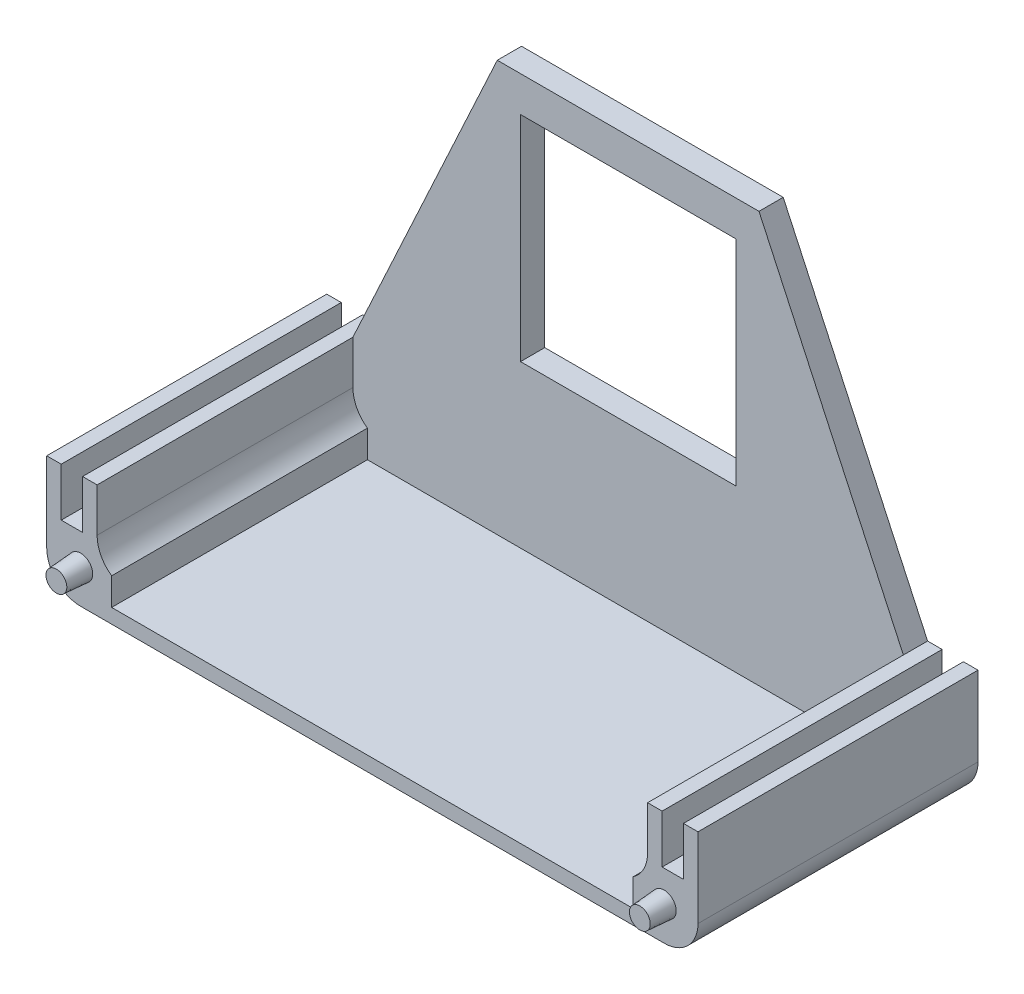
from build123d import *

# Parameters (mm, degrees)
EXTRUDE2_DEPTH               = 57.786
SKETCH2_R                    = 2.5
EXTRUDE3_DEPTH               = 5
EXTRUDE3_DRAFT               = 4
EXTRUDE3_PROFILE_2_DEPTH     = 5
EXTRUDE3_PROFILE_2_DRAFT     = 4
SKETCH4_R                    = 2.6
CUT_EXTRUDE1_DEPTH           = 5.2
CUT_EXTRUDE1_DRAFT           = -3.8
CUT_EXTRUDE1_PROFILE_2_DEPTH = 5.2
CUT_EXTRUDE1_PROFILE_2_DRAFT = -3.8
SKETCH3_W                    = 44.4182
SKETCH3_H                    = 44.1642
EXTRUDE4_DEPTH               = 5


with BuildPart() as part:
    # Sketch1 → Extrude2 (new body)
    with BuildSketch(Plane.XY):
        with BuildLine():
            Line((-60.2, 12.309521667), (60.2, 12.309521667))
            ThreePointArc((60.2, 12.309521667), (65.149747468, 14.359774199), (67.2, 19.309521667))
            Line((67.2, 19.309521667), (67.2, 35.709521667))
            Line((67.2, 35.709521667), (64.2, 35.709521667))
            Line((64.2, 35.709521667), (64.2, 25.709521667))
            Line((64.2, 25.709521667), (59.8, 25.709521667))
            Line((59.8, 25.709521667), (59.8, 35.709521667))
            Line((59.8, 35.709521667), (56.8, 35.709521667))
            Line((56.8, 35.709521667), (56.8, 26.709521667))
            ThreePointArc((56.8, 26.709521667), (56.004836823, 23.469151318), (53.8, 20.964959021))
            Line((53.8, 20.964959021), (53.8, 15.309521667))
            Line((53.8, 15.309521667), (-53.8, 15.309521667))
            Line((-53.8, 15.309521667), (-53.8, 20.964959021))
            ThreePointArc((-53.8, 20.964959021), (-56.004836823, 23.469151318), (-56.8, 26.709521667))
            Line((-56.8, 26.709521667), (-56.8, 35.709521667))
            Line((-56.8, 35.709521667), (-59.8, 35.709521667))
            Line((-59.8, 35.709521667), (-59.8, 25.709521667))
            Line((-59.8, 25.709521667), (-64.2, 25.709521667))
            Line((-64.2, 25.709521667), (-64.2, 35.709521667))
            Line((-64.2, 35.709521667), (-67.2, 35.709521667))
            Line((-67.2, 35.709521667), (-67.2, 19.309521667))
            ThreePointArc((-67.2, 19.309521667), (-65.149747468, 14.359774199), (-60.2, 12.309521667))
        make_face()
    extrude(amount=EXTRUDE2_DEPTH)


with BuildPart() as extrude3_tool:
    # Sketch2 → Extrude3 (with draft: the straight prism first)
    with BuildSketch(Plane.XY.offset(57.786)):
        with Locations((-60.2, 19.309521667)):
            Circle(SKETCH2_R)
    extrude(amount=EXTRUDE3_DEPTH)
    # Extrude3: the draft: its side faces are tilted about the plane it starts from
    extrude3_sides = [extrude3_tool.faces().sort_by_distance(p)[0] for p in [
        (-62.7, 19.309521667, 60.286),
    ]]
    draft(extrude3_sides, Plane.XY.offset(57.786), EXTRUDE3_DRAFT)


with BuildPart() as part_1:
    add(part.part)

    # Extrude3: add extrude3_tool
    add(extrude3_tool.part)


with BuildPart() as extrude3_profile_2_tool:
    # Sketch2 → Extrude3 profile 2 (with draft: the straight prism first)
    with BuildSketch(Plane.XY.offset(57.786)):
        with Locations((60.2, 19.309521667)):
            Circle(SKETCH2_R)
    extrude(amount=EXTRUDE3_PROFILE_2_DEPTH)
    # Extrude3 profile 2: the draft: its side faces are tilted about the plane it starts from
    extrude3_profile_2_sides = [extrude3_profile_2_tool.faces().sort_by_distance(p)[0] for p in [
        (57.7, 19.309521667, 60.286),
    ]]
    draft(extrude3_profile_2_sides, Plane.XY.offset(57.786), EXTRUDE3_PROFILE_2_DRAFT)


with BuildPart() as part_2:
    add(part_1.part)

    # Extrude3 profile 2: add extrude3_profile_2_tool
    add(extrude3_profile_2_tool.part)


with BuildPart() as cut_extrude1_tool:
    # Sketch4 → Cut-Extrude1 (with draft: the straight prism first)
    with BuildSketch(Plane(origin=(0, 0, 0), x_dir=(-1, 0, 0), z_dir=(0, 0, -1))):
        with Locations((-60.2, 19.309521667)):
            Circle(SKETCH4_R)
    extrude(amount=-CUT_EXTRUDE1_DEPTH)
    # Cut-Extrude1: the draft: its side faces are tilted about the plane it starts from
    cut_extrude1_sides = [cut_extrude1_tool.faces().sort_by_distance(p)[0] for p in [
        (62.8, 19.309521667, 2.6),
    ]]
    draft(cut_extrude1_sides, Plane(origin=(0, 0, 0), x_dir=(-1, 0, 0), z_dir=(0, 0, -1)), CUT_EXTRUDE1_DRAFT)


with BuildPart() as part_3:
    add(part_2.part)

    # Cut-Extrude1: cut by cut_extrude1_tool
    add(cut_extrude1_tool.part, mode=Mode.SUBTRACT)


with BuildPart() as cut_extrude1_profile_2_tool:
    # Sketch4 → Cut-Extrude1 profile 2 (with draft: the straight prism first)
    with BuildSketch(Plane(origin=(0, 0, 0), x_dir=(-1, 0, 0), z_dir=(0, 0, -1))):
        with Locations((60.2, 19.309521667)):
            Circle(SKETCH4_R)
    extrude(amount=-CUT_EXTRUDE1_PROFILE_2_DEPTH)
    # Cut-Extrude1 profile 2: the draft: its side faces are tilted about the plane it starts from
    cut_extrude1_profile_2_sides = [cut_extrude1_profile_2_tool.faces().sort_by_distance(p)[0] for p in [
        (-57.6, 19.309521667, 2.6),
    ]]
    draft(cut_extrude1_profile_2_sides, Plane(origin=(0, 0, 0), x_dir=(-1, 0, 0), z_dir=(0, 0, -1)), CUT_EXTRUDE1_PROFILE_2_DRAFT)


with BuildPart() as part_4:
    add(part_3.part)

    # Cut-Extrude1 profile 2: cut by cut_extrude1_profile_2_tool
    add(cut_extrude1_profile_2_tool.part, mode=Mode.SUBTRACT)


with BuildPart() as body_2:
    # Sketch3 → Extrude4 (new body)
    with BuildSketch(Plane(origin=(0, 0, 0), x_dir=(-1, 0, 0), z_dir=(0, 0, -1))):
        with BuildLine():
            Line((-27, 100.109521667), (27, 100.109521667))
            Line((27, 100.109521667), (56.8, 35.709521667))
            Line((56.8, 35.709521667), (56.8, 26.709521667))
            ThreePointArc((56.8, 26.709521667), (56.004836823, 23.469151318), (53.8, 20.964959021))
            Line((53.8, 20.964959021), (53.8, 15.309521667))
            Line((53.8, 15.309521667), (-53.8, 15.309521667))
            Line((-53.8, 15.309521667), (-53.8, 20.964959021))
            ThreePointArc((-53.8, 20.964959021), (-56.004836823, 23.469151318), (-56.8, 26.709521667))
            Line((-56.8, 26.709521667), (-56.8, 35.709521667))
            Line((-56.8, 35.709521667), (-27, 100.109521667))
        make_face()
        with Locations((0, 70.722421667)):
            Rectangle(SKETCH3_W, SKETCH3_H, mode=Mode.SUBTRACT)
    extrude(amount=-EXTRUDE4_DEPTH)


solid = Compound([part_4.part, body_2.part])
